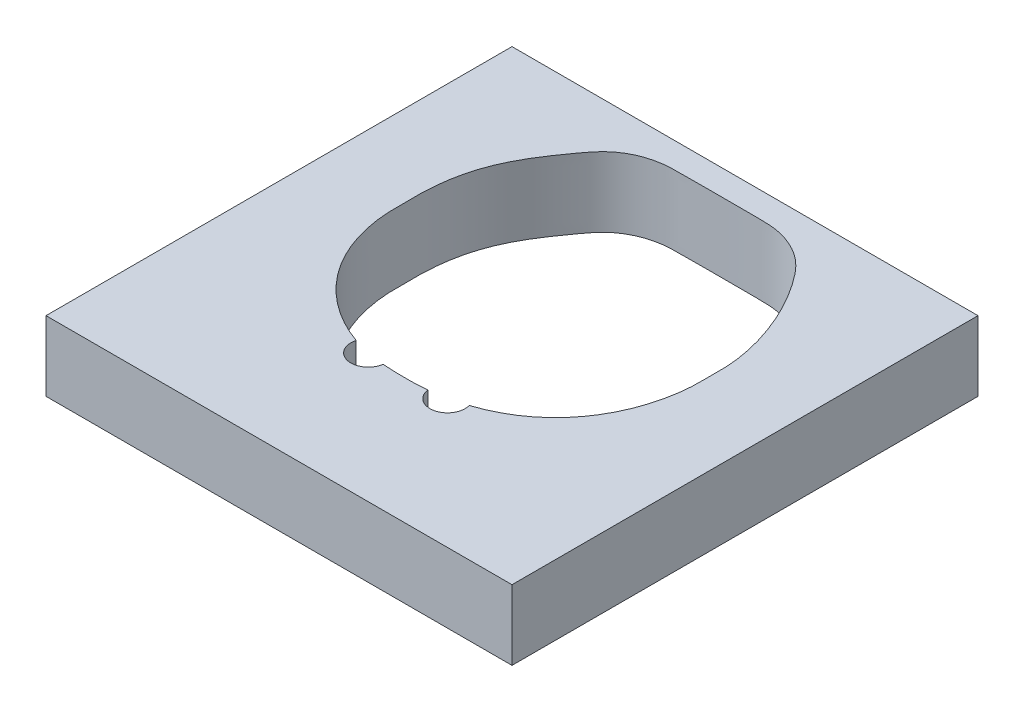
from build123d import *

# Parameters (mm, degrees)
ESQUISSE1_W             = 20
ESQUISSE1_H             = 20
BOSS_EXTRU_1_DEPTH      = 3
ESQUISSE3_R             = 0.75
ENL_V_MAT_EXTRU_1_DEPTH = 3


with BuildPart() as part:
    # Esquisse1 → Boss.-Extru.1 (new body)
    with BuildSketch(Plane(origin=(0, 0, 0), x_dir=(1, 0, 0), z_dir=(0, 1, 0))):
        with Locations((0, -2)):
            Rectangle(ESQUISSE1_W, ESQUISSE1_H)
        with BuildLine():
            add(Edge.make_bspline(
                [(-6.5, 0.021425618), (-6.565063138, 2.578432336), (-5.632782381, 4.102553172), (-3.903676203, 6.446852428), (-2.758160831, 6.899276222), (-0.878751888, 6.912168393), (1.130065999, 6.9136657), (2.762387867, 6.894575989), (3.913312434, 6.393724296), (5.683837223, 4.182928225), (6.55481217, 1.824257749), (6.494321325, -0.006355754), (6.512385425, -0.674969758), (6.245604325, -3.43668929), (4.325324504, -6.182451815), (0.542300843, -6.620044185), (-0.424881736, -6.607450435), (-3.091157441, -6.478339187), (-6.122763326, -4.404044401), (-6.516967238, -0.772884176), (-6.493763894, -0.201339557), (-6.499435316, -0.000766677), (-6.5, 0.021425618)],
                knots=[0, 0, 0, 0, 0.112371839, 0.130275732, 0.173620802, 0.187168536, 0.252205347, 0.266940035, 0.319780728, 0.343419676, 0.479690568, 0.498676785, 0.51429563, 0.54296722, 0.756721096, 0.785787005, 0.804560399, 0.825241089, 0.971913217, 0.99122251, 0.999024723, 1, 1, 1, 1], degree=3))
        make_face(mode=Mode.SUBTRACT)
    extrude(amount=BOSS_EXTRU_1_DEPTH)

    # Esquisse3 → Enlèv. mat.-Extru.1 (cut)
    with BuildSketch(Plane(origin=(0, 3, 0), x_dir=(1, 0, 0), z_dir=(0, 1, 0))):
        with Locations((-1.7, -6.467685331)):
            Circle(ESQUISSE3_R)
        with Locations((1.7, -6.467685331)):
            Circle(ESQUISSE3_R)
    extrude(amount=-ENL_V_MAT_EXTRU_1_DEPTH, mode=Mode.SUBTRACT)


solid = part.part
